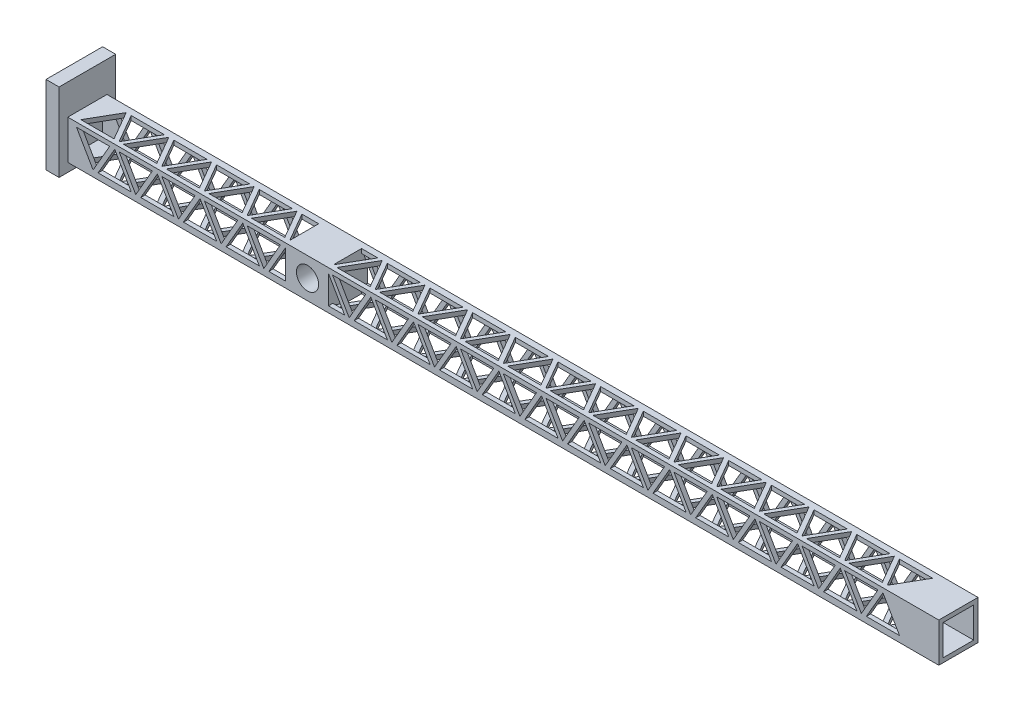
from build123d import *

# Parameters (mm, degrees)
SKETCH1_W                 = 1000
SKETCH1_H                 = 45
BOSS_EXTRUDE1_DEPTH       = 45
SKETCH2_W                 = 35
SKETCH2_H                 = 35
CUT_EXTRUDE1_DEPTH        = 1002.264825109
CUT_EXTRUDE2_DEPTH        = 45
LPATTERN1_COUNT           = 20
LPATTERN1_PITCH           = 49
CIRPATTERN1_COUNT         = 2
CIRPATTERN1_ANGLE         = 90
CIRPATTERN1_COPY_1_DEPTH  = 45
CIRPATTERN1_COPY_2_DEPTH  = 45
CIRPATTERN1_COPY_3_DEPTH  = 45
CIRPATTERN1_COPY_4_DEPTH  = 45
CIRPATTERN1_COPY_5_DEPTH  = 45
CIRPATTERN1_COPY_6_DEPTH  = 45
CIRPATTERN1_COPY_7_DEPTH  = 45
CIRPATTERN1_COPY_8_DEPTH  = 45
CIRPATTERN1_COPY_9_DEPTH  = 45
CIRPATTERN1_COPY_10_DEPTH = 45
CIRPATTERN1_COPY_11_DEPTH = 45
CIRPATTERN1_COPY_12_DEPTH = 45
CIRPATTERN1_COPY_13_DEPTH = 45
CIRPATTERN1_COPY_14_DEPTH = 45
CIRPATTERN1_COPY_15_DEPTH = 45
CIRPATTERN1_COPY_16_DEPTH = 45
CIRPATTERN1_COPY_17_DEPTH = 45
CIRPATTERN1_COPY_18_DEPTH = 45
BOSS_EXTRUDE2_START       = -45
SKETCH4_W                 = 49.245627384
SKETCH4_H                 = 45
BOSS_EXTRUDE2_DEPTH       = 45
SKETCH5_R                 = 12.75
CUT_EXTRUDE3_DEPTH        = 50
SKETCH6_W                 = 65
SKETCH6_H                 = 25
SKETCH6_H_2               = 65
END_CAP_DEPTH             = 15


with BuildPart() as part:
    # Sketch1 → Boss-Extrude1 (new body)
    with BuildSketch(Plane(origin=(0, 0, 0), x_dir=(1, 0, 0), z_dir=(0, 1, 0))):
        Rectangle(SKETCH1_W, SKETCH1_H)
    extrude(amount=BOSS_EXTRUDE1_DEPTH)

    # Sketch2 → Cut-Extrude1 (cut, through all)
    with BuildSketch(Plane(origin=(500, 0, 0), x_dir=(0, 0, -1), z_dir=(1, 0, 0))):
        with Locations((0, 22.5)):
            Rectangle(SKETCH2_W, SKETCH2_H)
    extrude(amount=-CUT_EXTRUDE1_DEPTH, mode=Mode.SUBTRACT)

    # Sketch3 → Cut-Extrude2 (cut)
    with BuildSketch(Plane.XY.offset(22.5)):
        Polygon((-470.947441117, 7), (-451.894882233, 40), (-490, 40), align=None)
        Polygon((-446.121379542, 40), (-465.173938425, 7), (-427.068820658, 7), align=None)
    cut_extrude2 = extrude(amount=-CUT_EXTRUDE2_DEPTH, mode=Mode.SUBTRACT)

    # LPattern1: Cut-Extrude2 ×20, 1 skipped
    with Locations(*[(i * LPATTERN1_PITCH, 0, 0) for i in range(1, LPATTERN1_COUNT) if i not in (19,)]):
        add(cut_extrude2, mode=Mode.SUBTRACT)

    # CirPattern1: Cut-Extrude2 ×2 about axis
    cirpattern1_axis = Axis((-550, 22.5, 0), (1, 0, 0))
    for i in range(1, CIRPATTERN1_COUNT):
        add(cut_extrude2.rotate(cirpattern1_axis, i * CIRPATTERN1_ANGLE / (CIRPATTERN1_COUNT - 1)), mode=Mode.SUBTRACT)

    # CirPattern1 copy 1 sketch → CirPattern1 copy 1 (cut)
    with BuildSketch(Plane(origin=(49, 0, -22.5), x_dir=(1, 0, 0), z_dir=(0, -1, 0))):
        Polygon((-470.947441117, 7), (-451.894882233, 40), (-490, 40), align=None)
        Polygon((-446.121379542, 40), (-465.173938425, 7), (-427.068820658, 7), align=None)
    extrude(amount=-CIRPATTERN1_COPY_1_DEPTH, mode=Mode.SUBTRACT)

    # CirPattern1 copy 2 sketch → CirPattern1 copy 2 (cut)
    with BuildSketch(Plane(origin=(98, 0, -22.5), x_dir=(1, 0, 0), z_dir=(0, -1, 0))):
        Polygon((-470.947441117, 7), (-451.894882233, 40), (-490, 40), align=None)
        Polygon((-446.121379542, 40), (-465.173938425, 7), (-427.068820658, 7), align=None)
    extrude(amount=-CIRPATTERN1_COPY_2_DEPTH, mode=Mode.SUBTRACT)

    # CirPattern1 copy 3 sketch → CirPattern1 copy 3 (cut)
    with BuildSketch(Plane(origin=(147, 0, -22.5), x_dir=(1, 0, 0), z_dir=(0, -1, 0))):
        Polygon((-470.947441117, 7), (-451.894882233, 40), (-490, 40), align=None)
        Polygon((-446.121379542, 40), (-465.173938425, 7), (-427.068820658, 7), align=None)
    extrude(amount=-CIRPATTERN1_COPY_3_DEPTH, mode=Mode.SUBTRACT)

    # CirPattern1 copy 4 sketch → CirPattern1 copy 4 (cut)
    with BuildSketch(Plane(origin=(196, 0, -22.5), x_dir=(1, 0, 0), z_dir=(0, -1, 0))):
        Polygon((-470.947441117, 7), (-451.894882233, 40), (-490, 40), align=None)
        Polygon((-446.121379542, 40), (-465.173938425, 7), (-427.068820658, 7), align=None)
    extrude(amount=-CIRPATTERN1_COPY_4_DEPTH, mode=Mode.SUBTRACT)

    # CirPattern1 copy 5 sketch → CirPattern1 copy 5 (cut)
    with BuildSketch(Plane(origin=(245, 0, -22.5), x_dir=(1, 0, 0), z_dir=(0, -1, 0))):
        Polygon((-470.947441117, 7), (-451.894882233, 40), (-490, 40), align=None)
        Polygon((-446.121379542, 40), (-465.173938425, 7), (-427.068820658, 7), align=None)
    extrude(amount=-CIRPATTERN1_COPY_5_DEPTH, mode=Mode.SUBTRACT)

    # CirPattern1 copy 6 sketch → CirPattern1 copy 6 (cut)
    with BuildSketch(Plane(origin=(294, 0, -22.5), x_dir=(1, 0, 0), z_dir=(0, -1, 0))):
        Polygon((-470.947441117, 7), (-451.894882233, 40), (-490, 40), align=None)
        Polygon((-446.121379542, 40), (-465.173938425, 7), (-427.068820658, 7), align=None)
    extrude(amount=-CIRPATTERN1_COPY_6_DEPTH, mode=Mode.SUBTRACT)

    # CirPattern1 copy 7 sketch → CirPattern1 copy 7 (cut)
    with BuildSketch(Plane(origin=(343, 0, -22.5), x_dir=(1, 0, 0), z_dir=(0, -1, 0))):
        Polygon((-470.947441117, 7), (-451.894882233, 40), (-490, 40), align=None)
        Polygon((-446.121379542, 40), (-465.173938425, 7), (-427.068820658, 7), align=None)
    extrude(amount=-CIRPATTERN1_COPY_7_DEPTH, mode=Mode.SUBTRACT)

    # CirPattern1 copy 8 sketch → CirPattern1 copy 8 (cut)
    with BuildSketch(Plane(origin=(392, 0, -22.5), x_dir=(1, 0, 0), z_dir=(0, -1, 0))):
        Polygon((-470.947441117, 7), (-451.894882233, 40), (-490, 40), align=None)
        Polygon((-446.121379542, 40), (-465.173938425, 7), (-427.068820658, 7), align=None)
    extrude(amount=-CIRPATTERN1_COPY_8_DEPTH, mode=Mode.SUBTRACT)

    # CirPattern1 copy 9 sketch → CirPattern1 copy 9 (cut)
    with BuildSketch(Plane(origin=(441, 0, -22.5), x_dir=(1, 0, 0), z_dir=(0, -1, 0))):
        Polygon((-470.947441117, 7), (-451.894882233, 40), (-490, 40), align=None)
        Polygon((-446.121379542, 40), (-465.173938425, 7), (-427.068820658, 7), align=None)
    extrude(amount=-CIRPATTERN1_COPY_9_DEPTH, mode=Mode.SUBTRACT)

    # CirPattern1 copy 10 sketch → CirPattern1 copy 10 (cut)
    with BuildSketch(Plane(origin=(490, 0, -22.5), x_dir=(1, 0, 0), z_dir=(0, -1, 0))):
        Polygon((-470.947441117, 7), (-451.894882233, 40), (-490, 40), align=None)
        Polygon((-446.121379542, 40), (-465.173938425, 7), (-427.068820658, 7), align=None)
    extrude(amount=-CIRPATTERN1_COPY_10_DEPTH, mode=Mode.SUBTRACT)

    # CirPattern1 copy 11 sketch → CirPattern1 copy 11 (cut)
    with BuildSketch(Plane(origin=(539, 0, -22.5), x_dir=(1, 0, 0), z_dir=(0, -1, 0))):
        Polygon((-470.947441117, 7), (-451.894882233, 40), (-490, 40), align=None)
        Polygon((-446.121379542, 40), (-465.173938425, 7), (-427.068820658, 7), align=None)
    extrude(amount=-CIRPATTERN1_COPY_11_DEPTH, mode=Mode.SUBTRACT)

    # CirPattern1 copy 12 sketch → CirPattern1 copy 12 (cut)
    with BuildSketch(Plane(origin=(588, 0, -22.5), x_dir=(1, 0, 0), z_dir=(0, -1, 0))):
        Polygon((-470.947441117, 7), (-451.894882233, 40), (-490, 40), align=None)
        Polygon((-446.121379542, 40), (-465.173938425, 7), (-427.068820658, 7), align=None)
    extrude(amount=-CIRPATTERN1_COPY_12_DEPTH, mode=Mode.SUBTRACT)

    # CirPattern1 copy 13 sketch → CirPattern1 copy 13 (cut)
    with BuildSketch(Plane(origin=(637, 0, -22.5), x_dir=(1, 0, 0), z_dir=(0, -1, 0))):
        Polygon((-470.947441117, 7), (-451.894882233, 40), (-490, 40), align=None)
        Polygon((-446.121379542, 40), (-465.173938425, 7), (-427.068820658, 7), align=None)
    extrude(amount=-CIRPATTERN1_COPY_13_DEPTH, mode=Mode.SUBTRACT)

    # CirPattern1 copy 14 sketch → CirPattern1 copy 14 (cut)
    with BuildSketch(Plane(origin=(686, 0, -22.5), x_dir=(1, 0, 0), z_dir=(0, -1, 0))):
        Polygon((-470.947441117, 7), (-451.894882233, 40), (-490, 40), align=None)
        Polygon((-446.121379542, 40), (-465.173938425, 7), (-427.068820658, 7), align=None)
    extrude(amount=-CIRPATTERN1_COPY_14_DEPTH, mode=Mode.SUBTRACT)

    # CirPattern1 copy 15 sketch → CirPattern1 copy 15 (cut)
    with BuildSketch(Plane(origin=(735, 0, -22.5), x_dir=(1, 0, 0), z_dir=(0, -1, 0))):
        Polygon((-470.947441117, 7), (-451.894882233, 40), (-490, 40), align=None)
        Polygon((-446.121379542, 40), (-465.173938425, 7), (-427.068820658, 7), align=None)
    extrude(amount=-CIRPATTERN1_COPY_15_DEPTH, mode=Mode.SUBTRACT)

    # CirPattern1 copy 16 sketch → CirPattern1 copy 16 (cut)
    with BuildSketch(Plane(origin=(784, 0, -22.5), x_dir=(1, 0, 0), z_dir=(0, -1, 0))):
        Polygon((-470.947441117, 7), (-451.894882233, 40), (-490, 40), align=None)
        Polygon((-446.121379542, 40), (-465.173938425, 7), (-427.068820658, 7), align=None)
    extrude(amount=-CIRPATTERN1_COPY_16_DEPTH, mode=Mode.SUBTRACT)

    # CirPattern1 copy 17 sketch → CirPattern1 copy 17 (cut)
    with BuildSketch(Plane(origin=(833, 0, -22.5), x_dir=(1, 0, 0), z_dir=(0, -1, 0))):
        Polygon((-470.947441117, 7), (-451.894882233, 40), (-490, 40), align=None)
        Polygon((-446.121379542, 40), (-465.173938425, 7), (-427.068820658, 7), align=None)
    extrude(amount=-CIRPATTERN1_COPY_17_DEPTH, mode=Mode.SUBTRACT)

    # CirPattern1 copy 18 sketch → CirPattern1 copy 18 (cut)
    with BuildSketch(Plane(origin=(882, 0, -22.5), x_dir=(1, 0, 0), z_dir=(0, -1, 0))):
        Polygon((-470.947441117, 7), (-451.894882233, 40), (-490, 40), align=None)
        Polygon((-446.121379542, 40), (-465.173938425, 7), (-427.068820658, 7), align=None)
    extrude(amount=-CIRPATTERN1_COPY_18_DEPTH, mode=Mode.SUBTRACT)

    # Sketch4 → Boss-Extrude2 (add)
    with BuildSketch(Plane.XY.offset(22.5).offset(BOSS_EXTRUDE2_START)):
        with Locations((-225.361433157, 22.5)):
            Rectangle(SKETCH4_W, SKETCH4_H)
    extrude(amount=BOSS_EXTRUDE2_DEPTH)

    # Sketch5 → Cut-Extrude3 (cut)
    with BuildSketch(Plane.XY.offset(22.5)):
        with Locations((-224.746267472, 22.5)):
            Circle(SKETCH5_R)
    extrude(amount=-CUT_EXTRUDE3_DEPTH, mode=Mode.SUBTRACT)


with BuildPart() as body_2:
    # Sketch6 → end cap (new body)
    with BuildSketch(Plane.ZY.offset(500)):
        with Locations((0, 67.5)):
            Rectangle(SKETCH6_W, SKETCH6_H)
        with Locations((0, 22.5)):
            Rectangle(SKETCH6_W, SKETCH6_H_2)
    extrude(amount=END_CAP_DEPTH)


solid = Compound([part.part, body_2.part])
